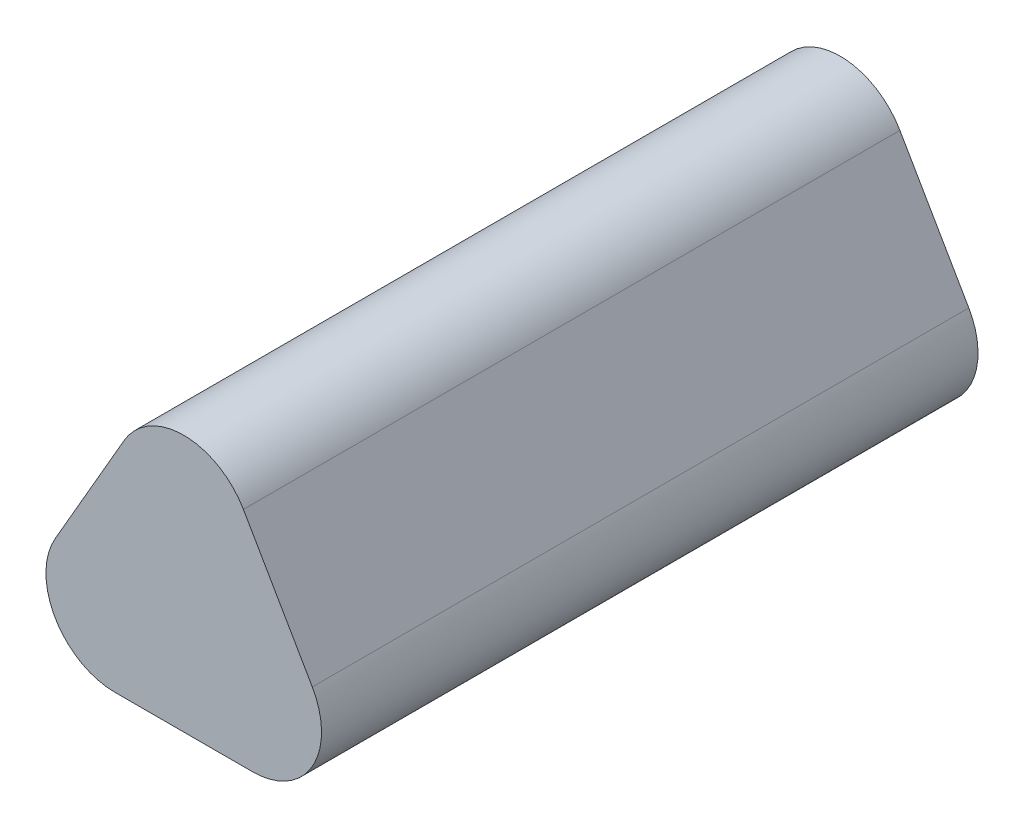
from build123d import *

# Parameters (mm, degrees)
EXTRUDE_1_DEPTH = 75


with BuildPart() as part:
    # 草图1 → 凸台-拉伸1 (new body)
    with BuildSketch(Plane.XY):
        with BuildLine():
            Line((-6.815619928, 3.935), (-14.685619928, -9.696239856))
            ThreePointArc((-14.685619928, -9.696239856), (-14.685619928, -17.566239856), (-7.87, -21.501239856))
            Line((-7.87, -21.501239856), (7.87, -21.501239856))
            ThreePointArc((7.87, -21.501239856), (14.685619928, -17.566239856), (14.685619928, -9.696239856))
            Line((14.685619928, -9.696239856), (6.815619928, 3.935))
            ThreePointArc((6.815619928, 3.935), (0, 7.87), (-6.815619928, 3.935))
        make_face()
    extrude(amount=EXTRUDE_1_DEPTH)


solid = part.part
